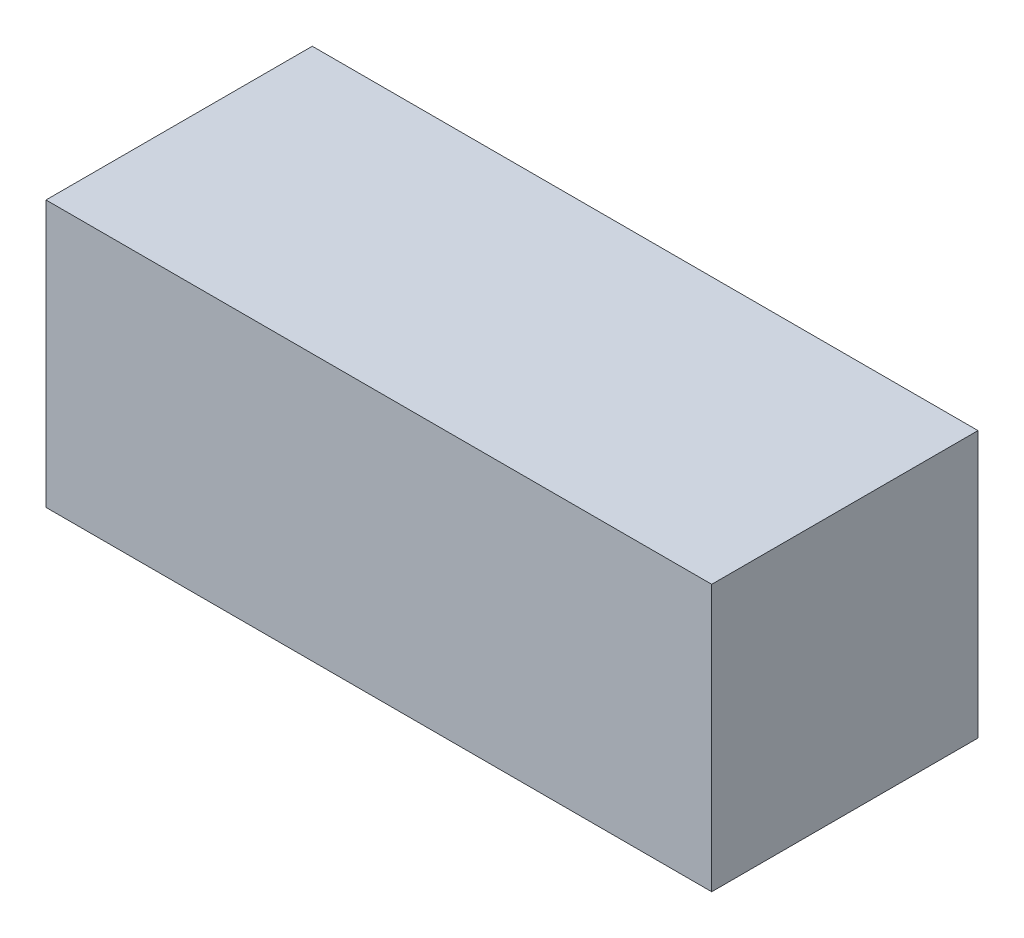
from build123d import *

# Parameters (mm, degrees)
SKETCH_1_W      = 50
SKETCH_1_H      = 20
EXTRUDE_1_DEPTH = 10


with BuildPart() as part:
    # 草圖1 → 填料-伸長1 (new, symmetric)
    with BuildSketch(Plane.XY):
        Rectangle(SKETCH_1_W, SKETCH_1_H)
    extrude(amount=EXTRUDE_1_DEPTH, both=True)


solid = part.part
